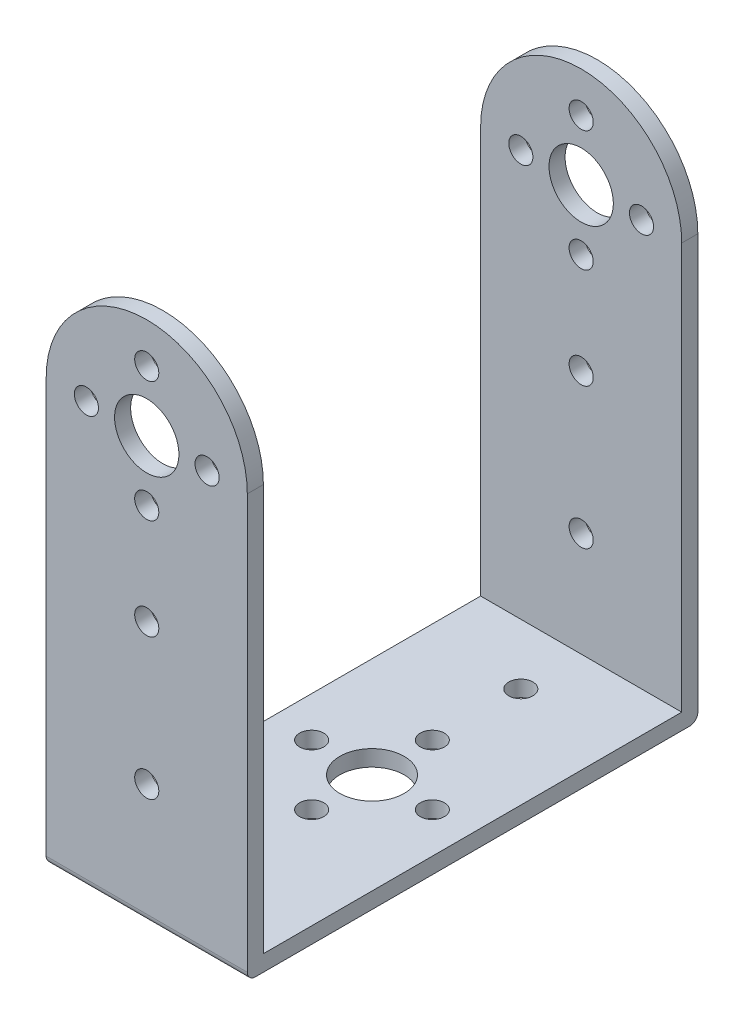
from build123d import *

# Parameters (mm, degrees)
SKETCH1_R           = 1.5
SKETCH1_R_2         = 4
BOSS_EXTRUDE1_DEPTH = 2
SKETCH5_R           = 1.5
SKETCH5_R_2         = 4
BOSS_EXTRUDE4_DEPTH = 2
SKETCH6_W           = 25
SKETCH6_H           = 56
BOSS_EXTRUDE5_DEPTH = 2
FILLET2_R           = 1
SKETCH7_R           = 4
SKETCH7_R_2         = 1.5
CUT_EXTRUDE1_DEPTH  = 2


with BuildPart() as part:
    # Sketch1 → Boss-Extrude1 (new body)
    with BuildSketch(Plane.XY):
        with BuildLine():
            Line((-12.5, -32.5), (12.5, -32.5))
            Line((12.5, -32.5), (12.5, 7.5))
            Line((12.5, 7.5), (12.5, 20))
            ThreePointArc((12.5, 20), (8.838834758, 28.838834772), (-2e-08, 32.5))
            ThreePointArc((-2e-08, 32.5), (-8.838834772, 28.838834758), (-12.5, 20))
            Line((-12.5, 20), (-12.5, 7.5))
            Line((-12.5, 7.5), (-12.5, -32.5))
        make_face()
        with Locations((0, -17.5)):
            Circle(SKETCH1_R, mode=Mode.SUBTRACT)
        Circle(SKETCH1_R, mode=Mode.SUBTRACT)
        with Locations((0, 12.5)):
            Circle(SKETCH1_R, mode=Mode.SUBTRACT)
        with Locations((-7.5, 20)):
            Circle(SKETCH1_R, mode=Mode.SUBTRACT)
        with Locations((0, 20)):
            Circle(SKETCH1_R_2, mode=Mode.SUBTRACT)
        with Locations((0, 27.5)):
            Circle(SKETCH1_R, mode=Mode.SUBTRACT)
        with Locations((7.5, 20)):
            Circle(SKETCH1_R, mode=Mode.SUBTRACT)
    extrude(amount=BOSS_EXTRUDE1_DEPTH)



with BuildPart() as body_2:
    # Sketch5 → Boss-Extrude4 (new body)
    with BuildSketch(Plane.XY.offset(54)):
        with BuildLine():
            Line((-12.5, -32.5), (12.5, -32.5))
            Line((12.5, -32.5), (12.5, 7.5))
            Line((12.5, 7.5), (12.5, 20))
            ThreePointArc((12.5, 20), (8.838834758, 28.838834772), (-2e-08, 32.5))
            ThreePointArc((-2e-08, 32.5), (-8.838834772, 28.838834758), (-12.5, 20))
            Line((-12.5, 20), (-12.5, 7.5))
            Line((-12.5, 7.5), (-12.5, -32.5))
        make_face()
        with Locations((0, -17.5)):
            Circle(SKETCH5_R, mode=Mode.SUBTRACT)
        Circle(SKETCH5_R, mode=Mode.SUBTRACT)
        with Locations((0, 12.5)):
            Circle(SKETCH5_R, mode=Mode.SUBTRACT)
        with Locations((-7.5, 20)):
            Circle(SKETCH5_R, mode=Mode.SUBTRACT)
        with Locations((0, 20)):
            Circle(SKETCH5_R_2, mode=Mode.SUBTRACT)
        with Locations((0, 27.5)):
            Circle(SKETCH5_R, mode=Mode.SUBTRACT)
        with Locations((7.5, 20)):
            Circle(SKETCH5_R, mode=Mode.SUBTRACT)
    extrude(amount=BOSS_EXTRUDE4_DEPTH)


with BuildPart() as part_1:
    add(part.part)

    add(body_2.part)  # Boss-Extrude5 merges body 2
    # Sketch6 → Boss-Extrude5 (add)
    with BuildSketch(Plane.XZ.offset(32.5)):
        with Locations((0, 28)):
            Rectangle(SKETCH6_W, SKETCH6_H)
    extrude(amount=-BOSS_EXTRUDE5_DEPTH)

    # Fillet2
    fillet2_edges = [part_1.edges().sort_by_distance(p)[0] for p in [
        (0, -32.5, 0),
        (0, -32.5, 56),
    ]]
    fillet(fillet2_edges, radius=FILLET2_R)

    # Sketch7 → Cut-Extrude1 (cut)
    with BuildSketch(Plane(origin=(0, -32.5, 0), x_dir=(-1, 0, 0), z_dir=(0, -1, 0))):
        with Locations(Location((0, -28, 0), (0, 0, 90))):
            Circle(SKETCH7_R)
        with Locations(Location((7.5, -28, 0), (0, 0, 90))):
            Circle(SKETCH7_R_2)
        with Locations(Location((0, -35.5, 0), (0, 0, 90))):
            Circle(SKETCH7_R_2)
        with Locations(Location((-7.5, -28, 0), (0, 0, 90))):
            Circle(SKETCH7_R_2)
        with Locations(Location((0, -20.5, 0), (0, 0, 90))):
            Circle(SKETCH7_R_2)
        with Locations(Location((0, -46.5, 0), (0, 0, 90))):
            Circle(SKETCH7_R_2)
        with Locations(Location((0, -9.5, 0), (0, 0, 90))):
            Circle(SKETCH7_R_2)
    extrude(amount=-CUT_EXTRUDE1_DEPTH, mode=Mode.SUBTRACT)


solid = part_1.part
